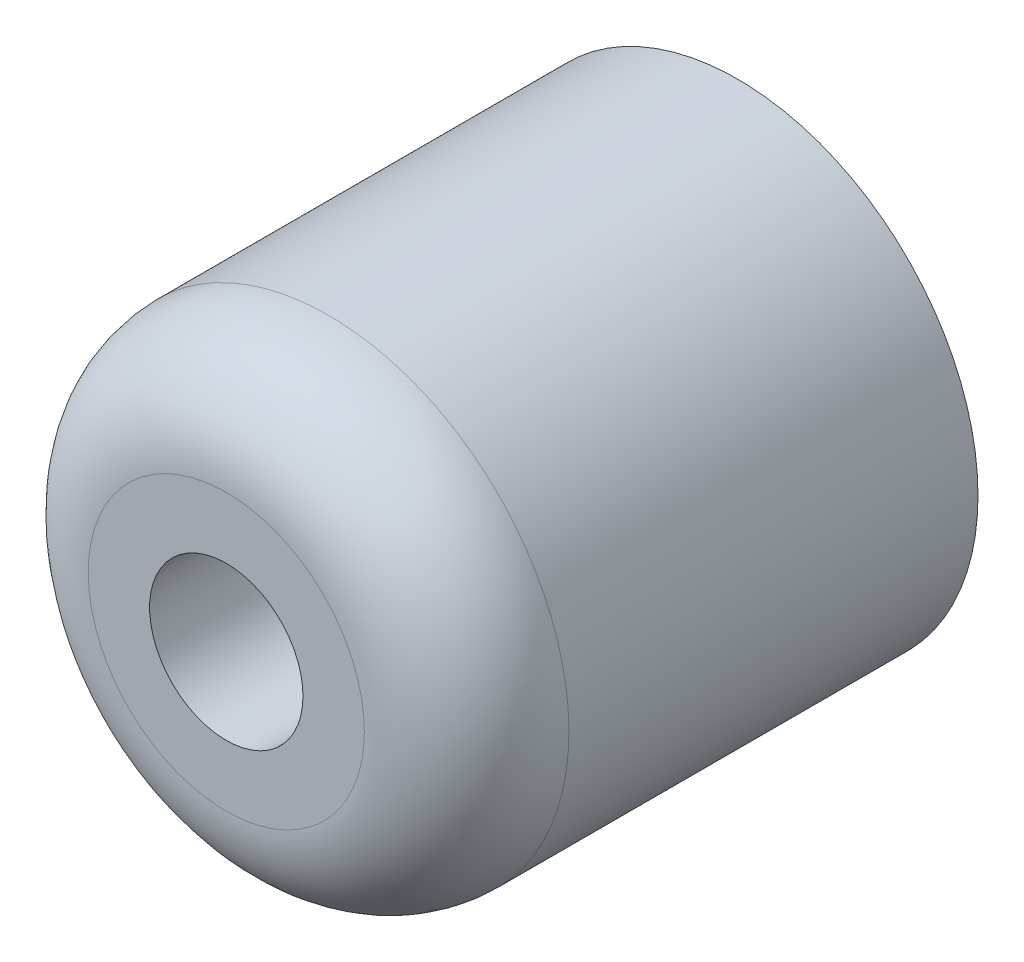
from build123d import *

# Parameters (mm, degrees)
SKETCH_2_R          = 23.5
EXTRUDE_1_DEPTH     = 50
FILLET_3_R          = 10
SHELL_2_T           = -2
SKETCH_5_R          = 9.5
EXTRUDE_2_DEPTH     = 48
SKETCH_6_R          = 2.4
CUT_EXTRUDE_1_DEPTH = 61.037488289
EXTRUDE_3_REACH     = 62.037
SKETCH_7_W          = 1.2
SKETCH_7_H          = 13
SKETCH_8_R          = 7.5
CUT_EXTRUDE_2_DEPTH = 39
CHAMFER_1_SIZE      = 3


with BuildPart() as part:
    # Эскиз2 → Бобышка-Вытянуть1 (new body)
    with BuildSketch(Plane.XY):
        Circle(SKETCH_2_R)
    extrude(amount=EXTRUDE_1_DEPTH)

    # Скругление3
    fillet_3_edges = [part.edges().sort_by_distance(p)[0] for p in [
        (-23.5, 0, 50),
    ]]
    fillet(fillet_3_edges, radius=FILLET_3_R)

    # Оболочка2
    shell_2_openings = [part.faces().sort_by_distance(p)[0] for p in [
        (0, 0, 0),
    ]]
    offset(amount=SHELL_2_T, openings=shell_2_openings, kind=Kind.INTERSECTION)

    # Эскиз5 → Бобышка-Вытянуть2 (add)
    with BuildSketch(Plane(origin=(0, 0, 48), x_dir=(-1, 0, 0), z_dir=(0, 0, -1))):
        with Locations(Location((0, 0, 0), (0, 0, 180))):
            Circle(SKETCH_5_R)
    extrude(amount=EXTRUDE_2_DEPTH)

    # Эскиз6 → Вырез-Вытянуть1 (cut, through all)
    with BuildSketch(Plane(origin=(0, 0, 0), x_dir=(-1, 0, 0), z_dir=(0, 0, -1))):
        Circle(SKETCH_6_R)
    extrude(amount=-CUT_EXTRUDE_1_DEPTH, mode=Mode.SUBTRACT)

    # Эскиз7 → Бобышка-Вытянуть3 (add, up to next)
    with BuildSketch(Plane(origin=(0, 0, 0), x_dir=(-1, 0, 0), z_dir=(0, 0, -1)), mode=Mode.PRIVATE) as extrude_3_sk1:
        with Locations((0, 15.437627965)):
            Rectangle(SKETCH_7_W, SKETCH_7_H)
    extrude_3_tool1 = extrude(extrude_3_sk1.sketch, amount=-EXTRUDE_3_REACH, mode=Mode.PRIVATE) - part.part
    # Эскиз7 → Бобышка-Вытянуть3 (add, up to next)
    with BuildSketch(Plane(origin=(0, 0, 0), x_dir=(-1, 0, 0), z_dir=(0, 0, -1)), mode=Mode.PRIVATE) as extrude_3_sk2:
        Polygon((7.440212867, 4.988429225), (18.698543116, 11.488429225), (19.298543116, 10.44919874), (8.040212867, 3.94919874), align=None)
    extrude_3_tool2 = extrude(extrude_3_sk2.sketch, amount=-EXTRUDE_3_REACH, mode=Mode.PRIVATE) - part.part
    # Эскиз7 → Бобышка-Вытянуть3 (add, up to next)
    with BuildSketch(Plane(origin=(0, 0, 0), x_dir=(-1, 0, 0), z_dir=(0, 0, -1)), mode=Mode.PRIVATE) as extrude_3_sk3:
        Polygon((8.040212867, -3.94919874), (19.298543117, -10.44919874), (18.698543117, -11.488429225), (7.440212867, -4.988429225), align=None)
    extrude_3_tool3 = extrude(extrude_3_sk3.sketch, amount=-EXTRUDE_3_REACH, mode=Mode.PRIVATE) - part.part
    # Эскиз7 → Бобышка-Вытянуть3 (add, up to next)
    with BuildSketch(Plane(origin=(0, 0, 0), x_dir=(-1, 0, 0), z_dir=(0, 0, -1)), mode=Mode.PRIVATE) as extrude_3_sk4:
        with Locations((0, -15.437627965)):
            Rectangle(SKETCH_7_W, SKETCH_7_H)
    extrude_3_tool4 = extrude(extrude_3_sk4.sketch, amount=-EXTRUDE_3_REACH, mode=Mode.PRIVATE) - part.part
    # Эскиз7 → Бобышка-Вытянуть3 (add, up to next)
    with BuildSketch(Plane(origin=(0, 0, 0), x_dir=(-1, 0, 0), z_dir=(0, 0, -1)), mode=Mode.PRIVATE) as extrude_3_sk5:
        Polygon((-7.440212867, -4.988429225), (-18.698543116, -11.488429225), (-19.298543116, -10.44919874), (-8.040212867, -3.94919874), align=None)
    extrude_3_tool5 = extrude(extrude_3_sk5.sketch, amount=-EXTRUDE_3_REACH, mode=Mode.PRIVATE) - part.part
    # Эскиз7 → Бобышка-Вытянуть3 (add, up to next)
    with BuildSketch(Plane(origin=(0, 0, 0), x_dir=(-1, 0, 0), z_dir=(0, 0, -1)), mode=Mode.PRIVATE) as extrude_3_sk6:
        Polygon((-8.040212867, 3.94919874), (-19.298543116, 10.44919874), (-18.698543116, 11.488429225), (-7.440212867, 4.988429225), align=None)
    extrude_3_tool6 = extrude(extrude_3_sk6.sketch, amount=-EXTRUDE_3_REACH, mode=Mode.PRIVATE) - part.part
    add(extrude_3_tool1.solids().sort_by_distance((0, 15.437628, 0))[0])
    add(extrude_3_tool2.solids().sort_by_distance((-13.369378, 7.718814, 0))[0])
    add(extrude_3_tool3.solids().sort_by_distance((-13.369378, -7.718814, 0))[0])
    add(extrude_3_tool4.solids().sort_by_distance((0, -15.437628, 0))[0])
    add(extrude_3_tool5.solids().sort_by_distance((13.369378, -7.718814, 0))[0])
    add(extrude_3_tool6.solids().sort_by_distance((13.369378, 7.718814, 0))[0])

    # Эскиз8 → Вырез-Вытянуть2 (cut)
    with BuildSketch(Plane.XY.offset(50)):
        Circle(SKETCH_8_R)
    extrude(amount=-CUT_EXTRUDE_2_DEPTH, mode=Mode.SUBTRACT)

    # Фаска1
    chamfer_1_edges = [part.edges().sort_by_distance(p)[0] for p in [
        (2.4, 0, 11),
    ]]
    chamfer(chamfer_1_edges, length=CHAMFER_1_SIZE)


solid = part.part
